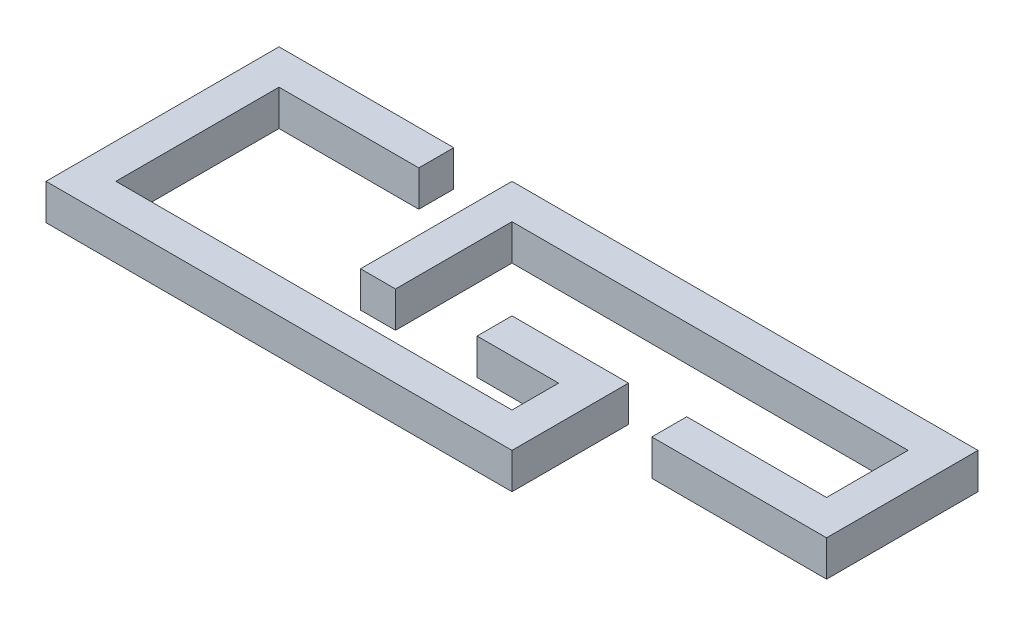
from build123d import *

# Parameters (mm, degrees)
BOSS_EXTRUDE1_DEPTH   = 2
BOSS_EXTRUDE1_2_DEPTH = 2


with BuildPart() as part:
    # Sketch1 → Boss-Extrude1 (new body)
    with BuildSketch(Plane(origin=(0, 0, 0), x_dir=(1, 0, 0), z_dir=(0, 1, 0))):
        Polygon((-6.5, 8.45), (-6.5, 0), (-4.55, 0), (-4.55, 6.5), (17.55, 6.5), (17.55, 1.95), (9.75, 1.95), (9.75, 0), (19.5, 0), (19.5, 8.45), align=None)
    extrude(amount=BOSS_EXTRUDE1_DEPTH)


with BuildPart() as body_2:
    # Sketch1 → Boss-Extrude1 2 (new body)
    with BuildSketch(Plane(origin=(0, 0, 0), x_dir=(1, 0, 0), z_dir=(0, 1, 0))):
        Polygon((-19.5, 8.45), (-19.5, -4.55), (6.5, -4.55), (6.5, 1.95), (0, 1.95), (0, 0), (4.55, 0), (4.55, -2.6), (-17.55, -2.6), (-17.55, 6.5), (-9.75, 6.5), (-9.75, 8.45), align=None)
    extrude(amount=BOSS_EXTRUDE1_2_DEPTH)


solid = Compound([part.part, body_2.part])
